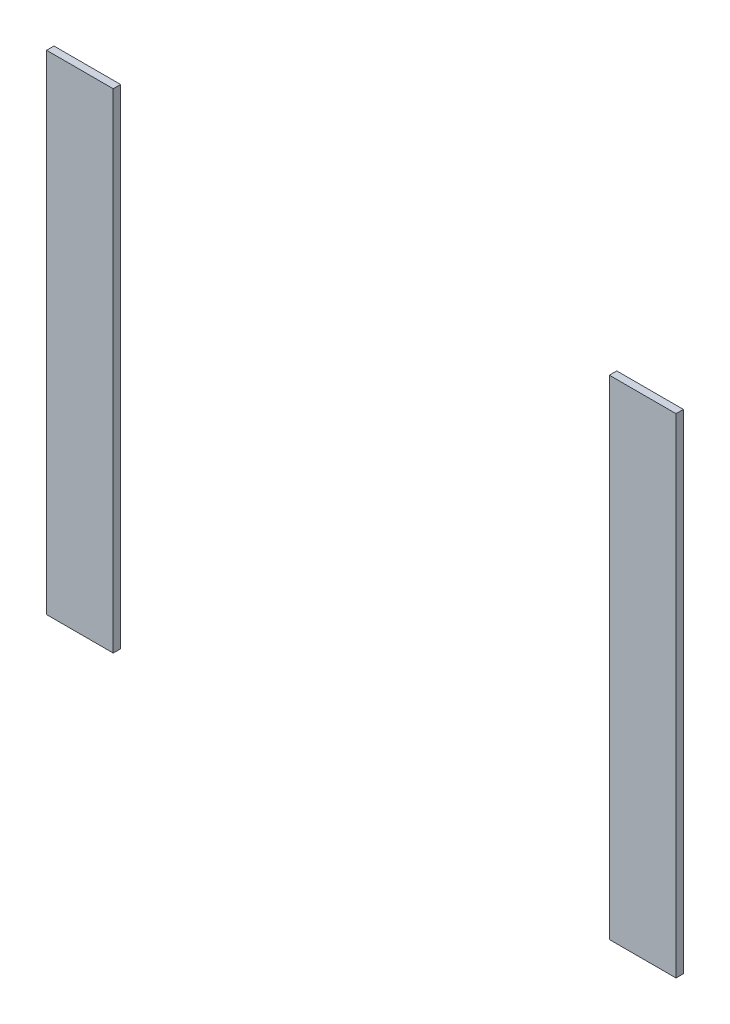
from build123d import *

# Parameters (mm, degrees)
BOSS_EXTRUDE1_DEPTH   = 10
BOSS_EXTRUDE1_2_DEPTH = 10


with BuildPart() as part:
    # Sketch1 → Boss-Extrude1 (new body)
    with BuildSketch(Plane.XY):
        Polygon((-335, 615), (-425, 615), (-425, -45), (-335, -45), (-335, 285), align=None)
    extrude(amount=BOSS_EXTRUDE1_DEPTH)


with BuildPart() as body_2:
    # Sketch1 → Boss-Extrude1 2 (new body)
    with BuildSketch(Plane.XY):
        Polygon((425, 615), (335, 615), (335, 285), (335, -45), (425, -45), align=None)
    extrude(amount=BOSS_EXTRUDE1_2_DEPTH)


solid = Compound([part.part, body_2.part])
